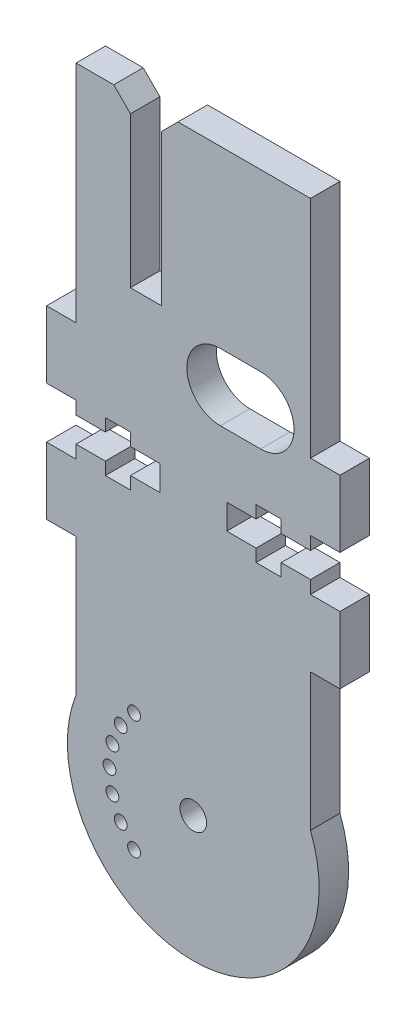
from build123d import *

# Parameters (mm, degrees)
BOSS_EXTRUDE1_DEPTH             = 2.794
CUT_EXTRUDE1_DEPTH              = 89.482328967
CUT_EXTRUDE1_DEPTH_BACK         = 89.482328967
BOSS_EXTRUDE2_REACH             = 90.482
SKETCH3_W                       = 5.588
SKETCH3_H                       = 12.7
BOSS_EXTRUDE2_DIRECTION_2_REACH = 90.482
BOSS_EXTRUDE3_REACH             = 92.049
SKETCH4_R                       = 2.5273
BOSS_EXTRUDE3_DIRECTION_2_REACH = 92.049
SKETCH6_R                       = 1.2192
CUT_EXTRUDE8_DEPTH              = 91.178457469
CHAMFER1_SIZE                   = 3.175
CUT_EXTRUDE10_DEPTH             = 91.178457469


with BuildPart() as part:
    # Sketch1 → Boss-Extrude1 (new, symmetric)
    with BuildSketch(Plane.XY):
        Polygon((-6.06425, 85.600032), (22.225, 85.600032), (22.225, 0), (-22.225, 0), (-22.225, 85.600032), (-11.90625, 85.600032), (-11.90625, 53.850032), (-6.06425, 53.850032), align=None)
    extrude(amount=BOSS_EXTRUDE1_DEPTH, both=True)

    # Sketch2 → Cut-Extrude1 (cut, two sides: drawn at the far end of the back side and taken through both)
    with BuildSketch(Plane.XY.offset(-CUT_EXTRUDE1_DEPTH_BACK)):
        Polygon((-22.225, 27.78125), (-16.66875, 27.78125), (-16.66875, 30.1625), (-11.90625, 30.1625), (-11.90625, 27.78125), (-6.35, 27.78125), (-6.35, 23.01875), (-11.90625, 23.01875), (-11.90625, 20.6375), (-16.66875, 20.6375), (-16.66875, 23.01875), (-22.225, 23.01875), align=None)
        Polygon((22.225, 27.78125), (16.66875, 27.78125), (16.66875, 30.1625), (11.90625, 30.1625), (11.90625, 27.78125), (6.35, 27.78125), (6.35, 23.01875), (11.90625, 23.01875), (11.90625, 20.6375), (16.66875, 20.6375), (16.66875, 23.01875), (22.225, 23.01875), align=None)
    extrude(amount=CUT_EXTRUDE1_DEPTH + CUT_EXTRUDE1_DEPTH_BACK, mode=Mode.SUBTRACT)

    # Boss-Extrude2: up to this face of the body (flat: up to its plane)
    boss_extrude2_end = Plane(part.part.faces().sort_by_distance((0.486906513, 42.340229634, 2.794))[0])
    # Sketch3 → Boss-Extrude2 (add, up to the picked face)
    with BuildSketch(Plane.XY, mode=Mode.PRIVATE) as boss_extrude2_sk1:
        with Locations((-25.019, 14.208252)):
            Rectangle(SKETCH3_W, SKETCH3_H)
    boss_extrude2_tool1 = split(extrude(boss_extrude2_sk1.sketch, amount=BOSS_EXTRUDE2_REACH, mode=Mode.PRIVATE), bisect_by=boss_extrude2_end, keep=Keep.BOTH, mode=Mode.PRIVATE)
    # Sketch3 → Boss-Extrude2 (add, up to the picked face)
    with BuildSketch(Plane.XY, mode=Mode.PRIVATE) as boss_extrude2_sk2:
        with Locations((25.019, 14.208252)):
            Rectangle(SKETCH3_W, SKETCH3_H)
    boss_extrude2_tool2 = split(extrude(boss_extrude2_sk2.sketch, amount=BOSS_EXTRUDE2_REACH, mode=Mode.PRIVATE), bisect_by=boss_extrude2_end, keep=Keep.BOTH, mode=Mode.PRIVATE)
    # Sketch3 → Boss-Extrude2 (add, up to the picked face)
    with BuildSketch(Plane.XY, mode=Mode.PRIVATE) as boss_extrude2_sk3:
        with Locations((-25.019, 36.591748)):
            Rectangle(SKETCH3_W, SKETCH3_H)
    boss_extrude2_tool3 = split(extrude(boss_extrude2_sk3.sketch, amount=BOSS_EXTRUDE2_REACH, mode=Mode.PRIVATE), bisect_by=boss_extrude2_end, keep=Keep.BOTH, mode=Mode.PRIVATE)
    # Sketch3 → Boss-Extrude2 (add, up to the picked face)
    with BuildSketch(Plane.XY, mode=Mode.PRIVATE) as boss_extrude2_sk4:
        with Locations((25.019, 36.591748)):
            Rectangle(SKETCH3_W, SKETCH3_H)
    boss_extrude2_tool4 = split(extrude(boss_extrude2_sk4.sketch, amount=BOSS_EXTRUDE2_REACH, mode=Mode.PRIVATE), bisect_by=boss_extrude2_end, keep=Keep.BOTH, mode=Mode.PRIVATE)
    add(boss_extrude2_tool1.solids().sort_by(Axis((-25.019, 14.208252, 0), (0, 0, 1)))[0])
    add(boss_extrude2_tool2.solids().sort_by(Axis((25.019, 14.208252, 0), (0, 0, 1)))[0])
    add(boss_extrude2_tool3.solids().sort_by(Axis((-25.019, 36.591748, 0), (0, 0, 1)))[0])
    add(boss_extrude2_tool4.solids().sort_by(Axis((25.019, 36.591748, 0), (0, 0, 1)))[0])

    # Boss-Extrude2 direction 2: up to this face of the body (flat: up to its plane)
    boss_extrude2_direction_2_end = Plane(part.part.faces().sort_by_distance((0.486906513, 42.340229634, -2.794))[0])
    # Sketch3 → Boss-Extrude2 direction 2 (add, up to the picked face)
    with BuildSketch(Plane.XY, mode=Mode.PRIVATE) as boss_extrude2_direction_2_sk1:
        with Locations((-25.019, 14.208252)):
            Rectangle(SKETCH3_W, SKETCH3_H)
    boss_extrude2_direction_2_tool1 = split(extrude(boss_extrude2_direction_2_sk1.sketch, amount=-BOSS_EXTRUDE2_DIRECTION_2_REACH, mode=Mode.PRIVATE), bisect_by=boss_extrude2_direction_2_end, keep=Keep.BOTH, mode=Mode.PRIVATE)
    # Sketch3 → Boss-Extrude2 direction 2 (add, up to the picked face)
    with BuildSketch(Plane.XY, mode=Mode.PRIVATE) as boss_extrude2_direction_2_sk2:
        with Locations((25.019, 14.208252)):
            Rectangle(SKETCH3_W, SKETCH3_H)
    boss_extrude2_direction_2_tool2 = split(extrude(boss_extrude2_direction_2_sk2.sketch, amount=-BOSS_EXTRUDE2_DIRECTION_2_REACH, mode=Mode.PRIVATE), bisect_by=boss_extrude2_direction_2_end, keep=Keep.BOTH, mode=Mode.PRIVATE)
    # Sketch3 → Boss-Extrude2 direction 2 (add, up to the picked face)
    with BuildSketch(Plane.XY, mode=Mode.PRIVATE) as boss_extrude2_direction_2_sk3:
        with Locations((-25.019, 36.591748)):
            Rectangle(SKETCH3_W, SKETCH3_H)
    boss_extrude2_direction_2_tool3 = split(extrude(boss_extrude2_direction_2_sk3.sketch, amount=-BOSS_EXTRUDE2_DIRECTION_2_REACH, mode=Mode.PRIVATE), bisect_by=boss_extrude2_direction_2_end, keep=Keep.BOTH, mode=Mode.PRIVATE)
    # Sketch3 → Boss-Extrude2 direction 2 (add, up to the picked face)
    with BuildSketch(Plane.XY, mode=Mode.PRIVATE) as boss_extrude2_direction_2_sk4:
        with Locations((25.019, 36.591748)):
            Rectangle(SKETCH3_W, SKETCH3_H)
    boss_extrude2_direction_2_tool4 = split(extrude(boss_extrude2_direction_2_sk4.sketch, amount=-BOSS_EXTRUDE2_DIRECTION_2_REACH, mode=Mode.PRIVATE), bisect_by=boss_extrude2_direction_2_end, keep=Keep.BOTH, mode=Mode.PRIVATE)
    add(boss_extrude2_direction_2_tool1.solids().sort_by(Axis((-25.019, 14.208252, 0), (0, 0, -1)))[0])
    add(boss_extrude2_direction_2_tool2.solids().sort_by(Axis((25.019, 14.208252, 0), (0, 0, -1)))[0])
    add(boss_extrude2_direction_2_tool3.solids().sort_by(Axis((-25.019, 36.591748, 0), (0, 0, -1)))[0])
    add(boss_extrude2_direction_2_tool4.solids().sort_by(Axis((25.019, 36.591748, 0), (0, 0, -1)))[0])

    # Boss-Extrude3: up to this face of the body (flat: up to its plane)
    boss_extrude3_end = Plane(part.part.faces().sort_by_distance((0.449618089, 41.042907789, 2.794))[0])
    # Sketch4 → Boss-Extrude3 (add, up to the picked face)
    with BuildSketch(Plane.XY, mode=Mode.PRIVATE) as boss_extrude3_sk1:
        with BuildLine():
            Line((-22.225, 0), (22.225, 0))
            Line((22.225, 0), (22.225, -18.161))
            ThreePointArc((22.225, -18.161), (0, -50.720463079), (-22.225, -18.161))
            Line((-22.225, -18.161), (-22.225, 0))
        make_face()
        with Locations(Location((0, -26.855369585, 0), (0, 0, 180))):
            Circle(SKETCH4_R, mode=Mode.SUBTRACT)
    boss_extrude3_tool1 = split(extrude(boss_extrude3_sk1.sketch, amount=BOSS_EXTRUDE3_REACH, mode=Mode.PRIVATE), bisect_by=boss_extrude3_end, keep=Keep.BOTH, mode=Mode.PRIVATE)
    add(boss_extrude3_tool1.solids().sort_by(Axis((0, -23.48752, 0), (0, 0, 1)))[0])

    # Boss-Extrude3 direction 2: up to this face of the body (flat: up to its plane)
    boss_extrude3_direction_2_end = Plane(part.part.faces().sort_by_distance((0.449618089, 41.042907789, -2.794))[0])
    # Sketch4 → Boss-Extrude3 direction 2 (add, up to the picked face)
    with BuildSketch(Plane.XY, mode=Mode.PRIVATE) as boss_extrude3_direction_2_sk1:
        with BuildLine():
            Line((-22.225, 0), (22.225, 0))
            Line((22.225, 0), (22.225, -18.161))
            ThreePointArc((22.225, -18.161), (0, -50.720463079), (-22.225, -18.161))
            Line((-22.225, -18.161), (-22.225, 0))
        make_face()
        with Locations(Location((0, -26.855369585, 0), (0, 0, 180))):
            Circle(SKETCH4_R, mode=Mode.SUBTRACT)
    boss_extrude3_direction_2_tool1 = split(extrude(boss_extrude3_direction_2_sk1.sketch, amount=-BOSS_EXTRUDE3_DIRECTION_2_REACH, mode=Mode.PRIVATE), bisect_by=boss_extrude3_direction_2_end, keep=Keep.BOTH, mode=Mode.PRIVATE)
    add(boss_extrude3_direction_2_tool1.solids().sort_by(Axis((0, -23.48752, 0), (0, 0, -1)))[0])

    # Sketch6 → Cut-Extrude8 (cut, through all)
    with BuildSketch(Plane.XY.offset(2.794)):
        with Locations((-15.875, -26.855369585)):
            Circle(SKETCH6_R)
        with Locations((-15.334072492, -22.746617244)):
            Circle(SKETCH6_R)
        with Locations((-13.748153285, -18.917869585)):
            Circle(SKETCH6_R)
        with Locations((-11.225320151, -15.630049433)):
            Circle(SKETCH6_R)
        with Locations((-11.225320151, -38.080689736)):
            Circle(SKETCH6_R)
        with Locations((-13.748153285, -34.792869585)):
            Circle(SKETCH6_R)
        with Locations((-15.334072492, -30.964121926)):
            Circle(SKETCH6_R)
    extrude(amount=-CUT_EXTRUDE8_DEPTH, mode=Mode.SUBTRACT)

    # Chamfer1
    chamfer1_edges = [part.edges().sort_by_distance(p)[0] for p in [
        (-11.90625, 85.600032, 0),
        (-6.06425, 85.600032, 0),
    ]]
    chamfer(chamfer1_edges, length=CHAMFER1_SIZE)

    # Sketch8 → Cut-Extrude10 (cut, through all)
    with BuildSketch(Plane.XY.offset(2.794)):
        with BuildLine():
            Line((5.129422909, 52.414421713), (12.749422909, 52.414421713))
            ThreePointArc((12.749422909, 52.414421713), (19.099422909, 46.064421713), (12.749422909, 39.714421713))
            Line((12.749422909, 39.714421713), (5.129422909, 39.714421713))
            ThreePointArc((5.129422909, 39.714421713), (-1.220577091, 46.064421713), (5.129422909, 52.414421713))
        make_face()
    extrude(amount=-CUT_EXTRUDE10_DEPTH, mode=Mode.SUBTRACT)


solid = part.part
